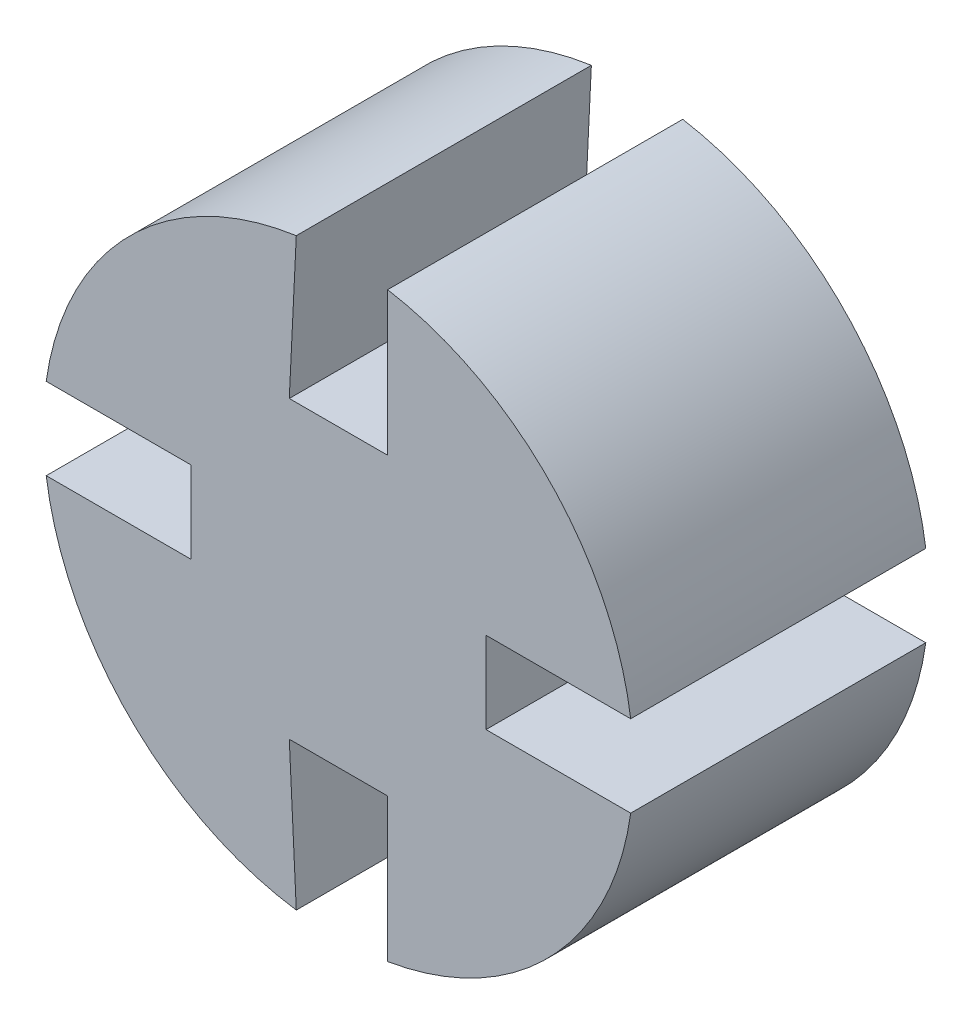
from build123d import *

# Parameters (mm, degrees)
SALIENTE_EXTRUIR1_DEPTH = 60


with BuildPart() as part:
    # Croquis1 → Saliente-Extruir1 (new body)
    with BuildSketch(Plane.XY):
        with BuildLine():
            Line((-8.57523763, 59.384049202), (-10, 30))
            Line((-10, 30), (10, 30))
            Line((10, 30), (10, 59.160797831))
            ThreePointArc((10, 59.160797831), (43.028053102, 41.816105106), (59.422289674, 8.306111602))
            Line((59.422289674, 8.306111602), (30, 8.306111602))
            Line((30, 8.306111602), (30, -8.306111602))
            Line((30, -8.306111602), (59.422289674, -8.306111602))
            ThreePointArc((59.422289674, -8.306111602), (43.028053102, -41.816105106), (10, -59.160797831))
            Line((10, -59.160797831), (10, -30))
            Line((10, -30), (-10, -30))
            Line((-10, -30), (-8.57523763, -59.384049202))
            ThreePointArc((-8.57523763, -59.384049202), (-42.52240418, -42.330191858), (-59.422289674, -8.306111602))
            Line((-59.422289674, -8.306111602), (-30, -8.306111602))
            Line((-30, -8.306111602), (-30, 8.306111602))
            Line((-30, 8.306111602), (-59.422289674, 8.306111602))
            ThreePointArc((-59.422289674, 8.306111602), (-42.52240418, 42.330191858), (-8.57523763, 59.384049202))
        make_face()
    extrude(amount=SALIENTE_EXTRUIR1_DEPTH)


solid = part.part
